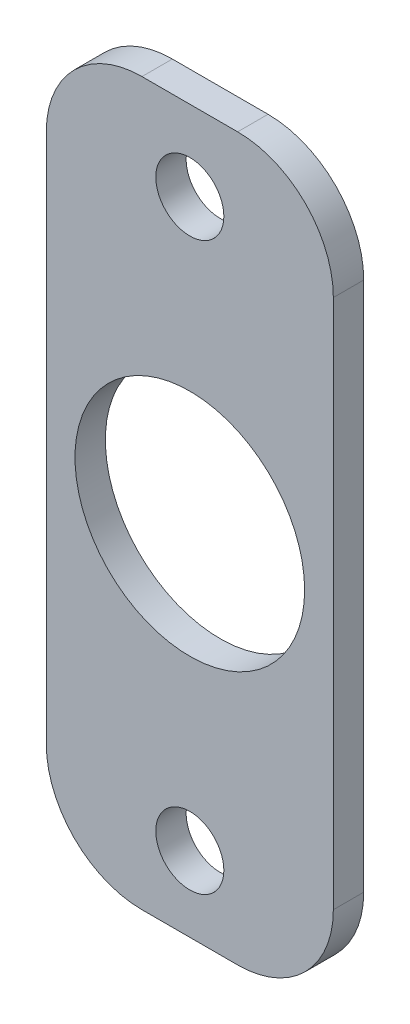
from build123d import *

# Parameters (mm, degrees)
SKETCH1_W           = 101.6
SKETCH1_H           = 101.6
BOSS_EXTRUDE1_DEPTH = 1.5875
SKETCH2_R           = 5.999999938
CUT_EXTRUDE1_DEPTH  = 190.018384556
SKETCH4_R           = 1.778
CUT_EXTRUDE2_DEPTH  = 190.018384556
SKETCH5_W           = 43.3
SKETCH5_H           = 101.6
CUT_EXTRUDE4_DEPTH  = 190.018384556
SKETCH10_W          = 15
SKETCH10_H          = 31.816690228
SKETCH10_H_2        = 32.081483739
CUT_EXTRUDE5_DEPTH  = 155.410769427
FILLET1_R           = 5


with BuildPart() as part:
    # Sketch1 → Boss-Extrude1 (new body)
    with BuildSketch(Plane.XY):
        with Locations((-108.093233083, 51.563909774)):
            Rectangle(SKETCH1_W, SKETCH1_H)
    extrude(amount=BOSS_EXTRUDE1_DEPTH)

    # Sketch2 → Cut-Extrude1 (cut, through all)
    with BuildSketch(Plane.XY.offset(1.5875)):
        with Locations((-108.093233083, 51.563909774)):
            Circle(SKETCH2_R)
    extrude(amount=-CUT_EXTRUDE1_DEPTH, mode=Mode.SUBTRACT)

    # Sketch4 → Cut-Extrude2 (cut, through all)
    with BuildSketch(Plane.XY.offset(1.5875)):
        with Locations((-108.093233083, 66.360241624)):
            Circle(SKETCH4_R)
        with Locations((-108.093233083, 36.767577924)):
            Circle(SKETCH4_R)
    extrude(amount=-CUT_EXTRUDE2_DEPTH, mode=Mode.SUBTRACT)

    # Sketch5 → Cut-Extrude4 (cut, through all)
    with BuildSketch(Plane.XY.offset(1.5875)):
        with Locations((-137.243233083, 51.563909774)):
            Rectangle(SKETCH5_W, SKETCH5_H)
        with Locations((-78.943233083, 51.563909774)):
            Rectangle(SKETCH5_W, SKETCH5_H)
    extrude(amount=-CUT_EXTRUDE4_DEPTH, mode=Mode.SUBTRACT)

    # Sketch10 → Cut-Extrude5 (cut, through all)
    with BuildSketch(Plane.XY.offset(1.5875)):
        with Locations((-108.093233083, 86.45556466)):
            Rectangle(SKETCH10_W, SKETCH10_H)
        with Locations((-108.093233083, 16.804651644)):
            Rectangle(SKETCH10_W, SKETCH10_H_2)
    extrude(amount=-CUT_EXTRUDE5_DEPTH, mode=Mode.SUBTRACT)

    # Fillet1
    fillet1_edges = [part.edges().sort_by_distance(p)[0] for p in [
        (-115.593233083, 70.547219546, 0.79375),
        (-100.593233083, 70.547219546, 0.79375),
        (-100.593233083, 32.845393513, 0.79375),
        (-115.593233083, 32.845393513, 0.79375),
    ]]
    fillet(fillet1_edges, radius=FILLET1_R)


solid = part.part
